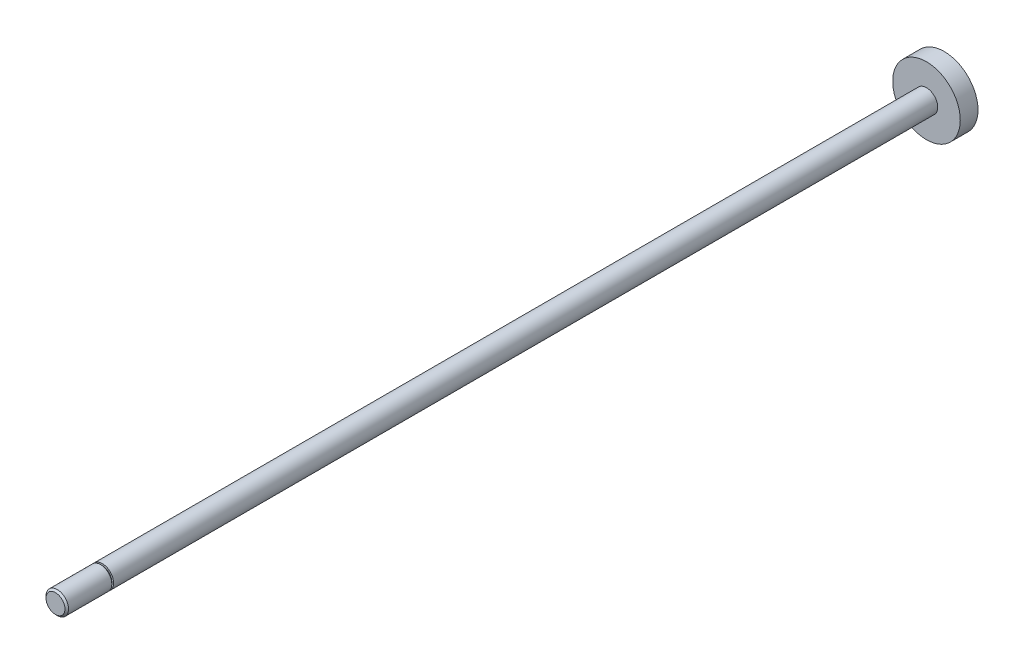
from build123d import *

# Parameters (mm, degrees)
SKETCH1_R      = 3.175
EXTRUDE1_DEPTH = 248.031
SKETCH2_R      = 9.525
PISTON_DEPTH   = 2.5


with BuildPart() as part:
    # Sketch1 → Extrude1 (new body)
    with BuildSketch(Plane.XY):
        with Locations(Location((0, 0, 0), (0, 0, 180))):
            Circle(SKETCH1_R)
    extrude(amount=EXTRUDE1_DEPTH)

    # Sketch2 → Piston (add, symmetric)
    with BuildSketch(Plane.XY):
        Circle(SKETCH2_R)
    extrude(amount=PISTON_DEPTH, both=True)

    # Sketch3 → Threads (revolve, cut)
    with BuildSketch(Plane(origin=(0, 0, 0), x_dir=(0, 0, -1), z_dir=(1, 0, 0)), mode=Mode.PRIVATE) as threads_sk:
        Polygon((-248.031, 9.525), (-234.831, 9.525), (-234.831, 2.675), (-235.331, 2.675), (-235.331, 3.175), (-247.531, 3.175), (-248.031, 2.675), align=None)
    revolve(threads_sk.sketch.rotate(Axis((0, 0, 0), (0, 0, 1)), 90), axis=Axis((0, 0, 0), (0, 0, 1)), mode=Mode.SUBTRACT)


solid = part.part
